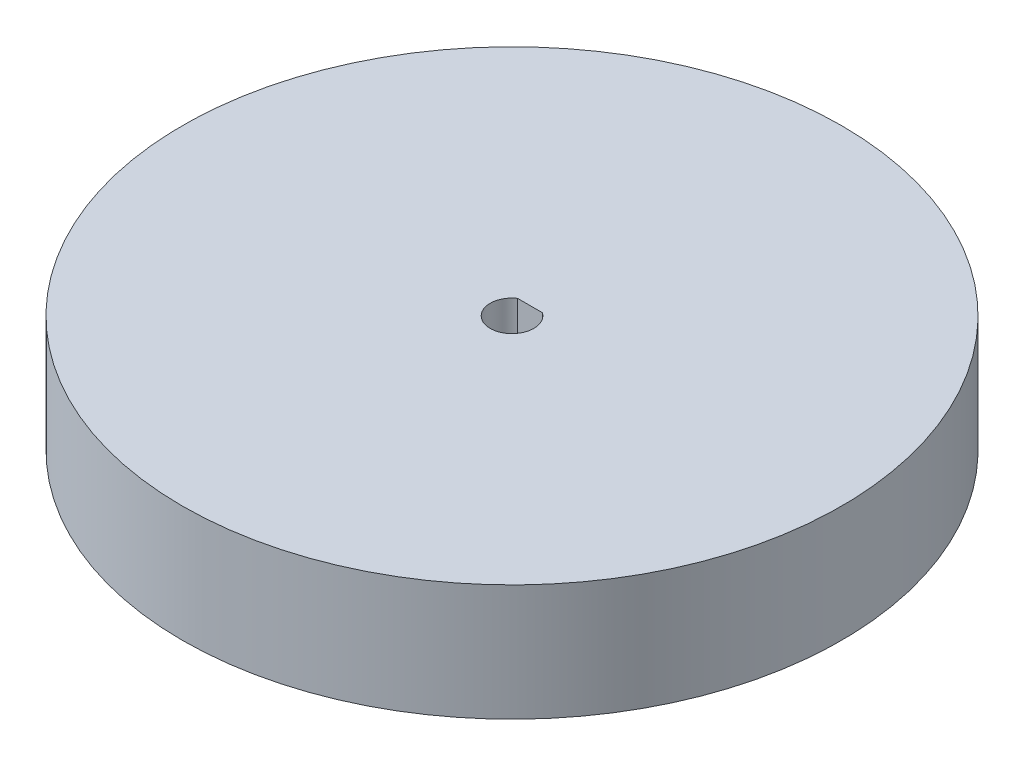
from build123d import *

# Parameters (mm, degrees)
SKETCH2_R           = 43.18
BOSS_EXTRUDE1_DEPTH = 15.24
CUT_EXTRUDE1_DEPTH  = 63.938719402


with BuildPart() as part:
    # Sketch2 → Boss-Extrude1 (new body)
    with BuildSketch(Plane(origin=(0, 0, 0), x_dir=(1, 0, 0), z_dir=(0, 1, 0))):
        with Locations(Location((0, 0, 0), (0, 0, 90))):
            Circle(SKETCH2_R)
    extrude(amount=BOSS_EXTRUDE1_DEPTH)

    # Sketch3 → Cut-Extrude1 (cut, through all)
    with BuildSketch(Plane(origin=(0, 15.24, 0), x_dir=(1, 0, 0), z_dir=(0, 1, 0))):
        with BuildLine():
            Line((1.626393556, 2.3495), (-1.626393556, 2.3495))
            ThreePointArc((-1.626393556, 2.3495), (-1.326251609, -2.531079398), (2.8575, 0))
            ThreePointArc((2.8575, 0), (2.531079398, 1.326251609), (1.626393556, 2.3495))
        make_face()
    extrude(amount=-CUT_EXTRUDE1_DEPTH, mode=Mode.SUBTRACT)


solid = part.part
